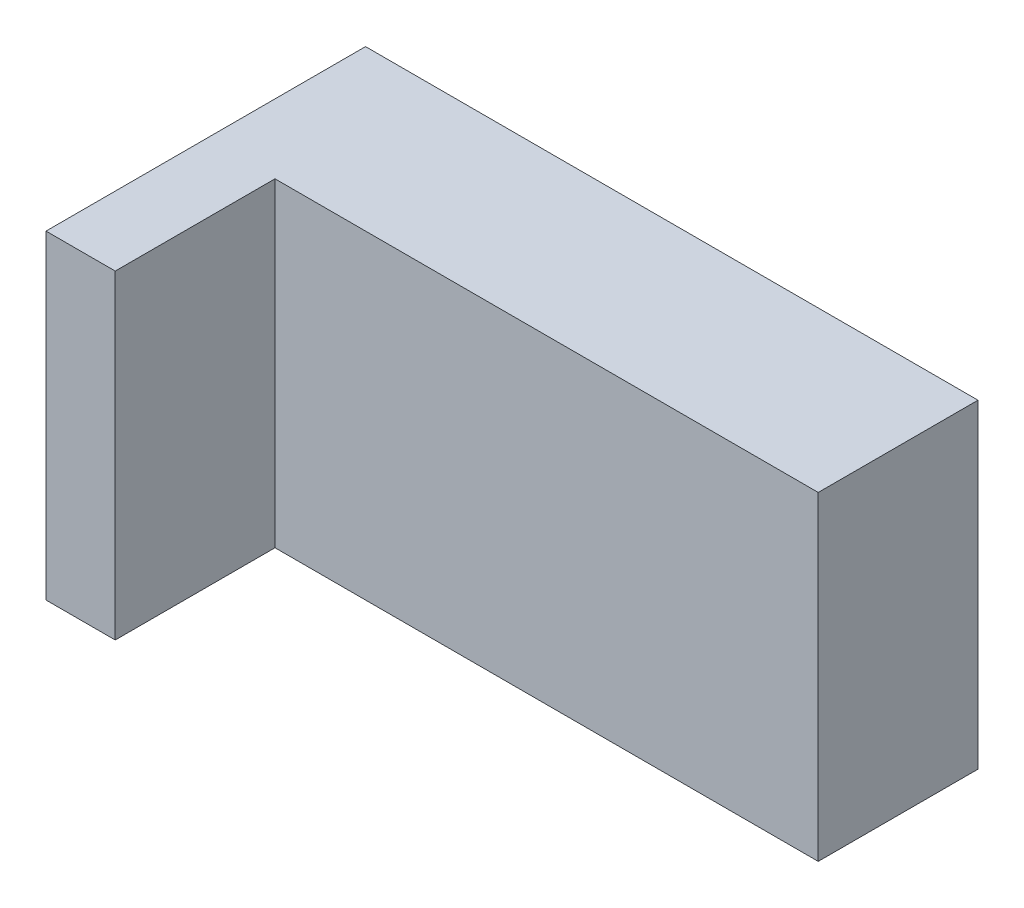
from build123d import *

# Parameters (mm, degrees)
SKETCH_1_W      = 230
SKETCH_1_H      = 120
EXTRUDE_1_DEPTH = 60
SKETCH_2_W      = 26
SKETCH_2_H      = 120
EXTRUDE_2_DEPTH = 60


with BuildPart() as part:
    # 草图1 → 凸台-拉伸1 (new body)
    with BuildSketch(Plane.XY):
        Rectangle(SKETCH_1_W, SKETCH_1_H)
    extrude(amount=EXTRUDE_1_DEPTH)

    # 草图2 → 凸台-拉伸2 (add)
    with BuildSketch(Plane.XY.offset(60)):
        with Locations((-102, 0)):
            Rectangle(SKETCH_2_W, SKETCH_2_H)
    extrude(amount=EXTRUDE_2_DEPTH)


solid = part.part
